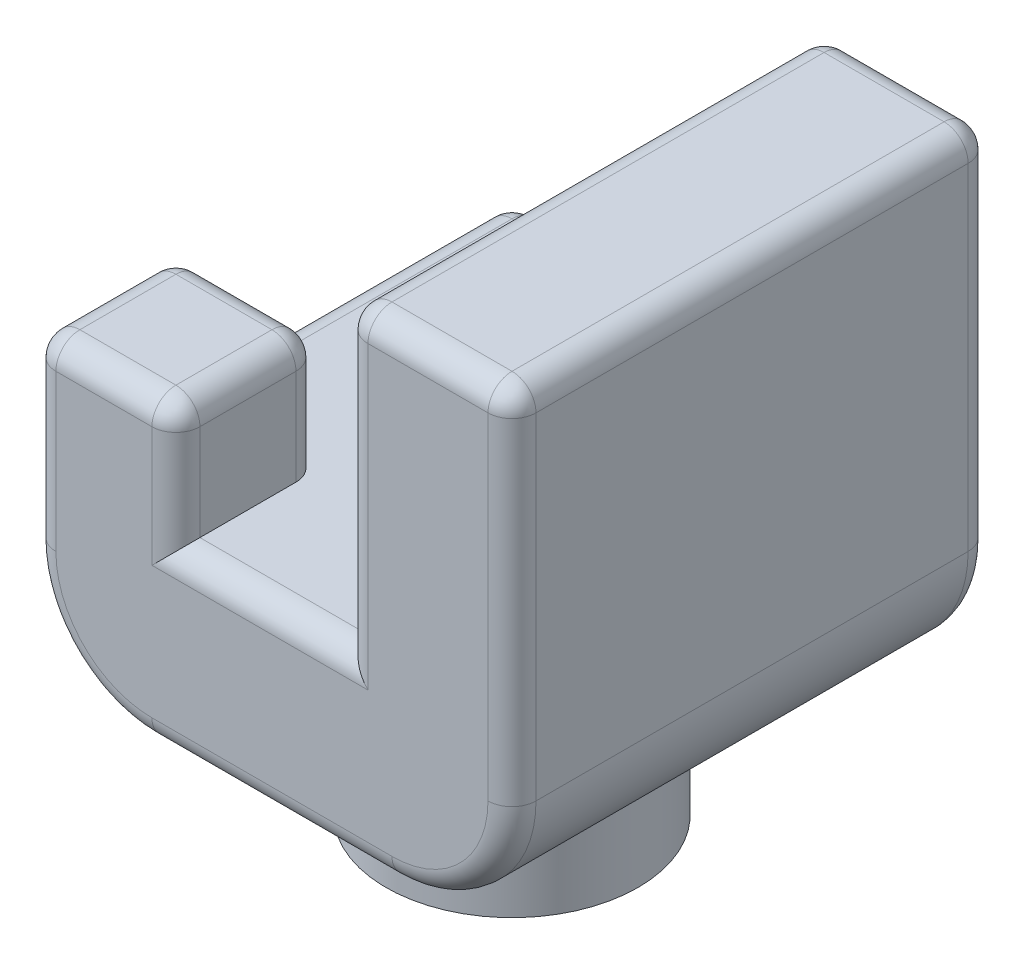
from build123d import *

# Parameters (mm, degrees)
SKETCH1_W           = 20
SKETCH1_H           = 20
BOSS_EXTRUDE1_DEPTH = 20
CUT_EXTRUDE1_DEPTH  = 25
SKETCH3_W           = 14
SKETCH3_H           = 5
CUT_EXTRUDE2_DEPTH  = 12
FILLET2_R           = 5
FILLET3_R           = 1
FILLET4_R           = 1
SKETCH4_R           = 5.25
BOSS_EXTRUDE2_DEPTH = 5


with BuildPart() as part:
    # Sketch1 → Boss-Extrude1 (new body)
    with BuildSketch(Plane.XY):
        Rectangle(SKETCH1_W, SKETCH1_H)
    extrude(amount=BOSS_EXTRUDE1_DEPTH)

    # Sketch2 → Cut-Extrude1 (cut)
    with BuildSketch(Plane.XY.offset(20)):
        Polygon((3, -2.5), (3, 10), (-10, 10), (-10, 2.5), (-4, 2.5), (-4, -2.5), align=None)
    extrude(amount=-CUT_EXTRUDE1_DEPTH, mode=Mode.SUBTRACT)

    # Sketch3 → Cut-Extrude2 (cut)
    with BuildSketch(Plane.ZY.offset(10)):
        with Locations((7, 0)):
            Rectangle(SKETCH3_W, SKETCH3_H)
    extrude(amount=-CUT_EXTRUDE2_DEPTH, mode=Mode.SUBTRACT)

    # Fillet2
    fillet2_edges = [part.edges().sort_by_distance(p)[0] for p in [
        (10, -10, 10),
        (-10, -10, 10),
    ]]
    fillet(fillet2_edges, radius=FILLET2_R)

    # Fillet3
    fillet3_edges = [part.edges().sort_by_distance(p)[0] for p in [
        (3, 3.75, 0),
        (-10, -1.25, 20),
        (-4, 0, 20),
        (3, 3.75, 20),
        (-4, 0, 14),
        (-10, -3.75, 0),
        (-10, 0, 14),
        (10, 2.5, 0),
        (10, 2.5, 20),
        (0, -10, 0),
        (-8.535533906, -8.535533906, 0),
        (8.535533906, -8.535533906, 0),
        (0, -10, 20),
        (-8.535533906, -8.535533906, 20),
        (8.535533906, -8.535533906, 20),
    ]]
    fillet(fillet3_edges, radius=FILLET3_R)

    # Fillet4
    fillet4_edges = [part.edges().sort_by_distance(p)[0] for p in [
        (-2.5, -2.5, 0),
        (-9.707106781, -2.5, 0.292893219),
        (3.292893219, 10, 0.292893219),
        (6.5, 10, 0),
        (9.707106781, 10, 0.292893219),
        (10, 10, 10),
        (9.707106781, 10, 19.707106781),
        (6.5, 10, 20),
        (3.292893219, 10, 19.707106781),
        (-9.707106781, 2.5, 14.292893219),
        (-4.292893219, 2.5, 14.292893219),
        (-4, 2.5, 17),
        (-4.292893219, 2.5, 19.707106781),
        (-7, 2.5, 20),
        (-9.707106781, 2.5, 19.707106781),
        (-10, -2.5, 8),
        (-0.5, -2.5, 20),
        (3, 10, 10),
        (-7, 2.5, 14),
        (-10, 2.5, 17),
    ]]
    fillet(fillet4_edges, radius=FILLET4_R)

    # Sketch4 → Boss-Extrude2 (add)
    with BuildSketch(Plane.XZ.offset(10)):
        with Locations(Location((0, 10, 0), (0, 0, 17.752790162))):
            Circle(SKETCH4_R)
    extrude(amount=BOSS_EXTRUDE2_DEPTH)


solid = part.part
